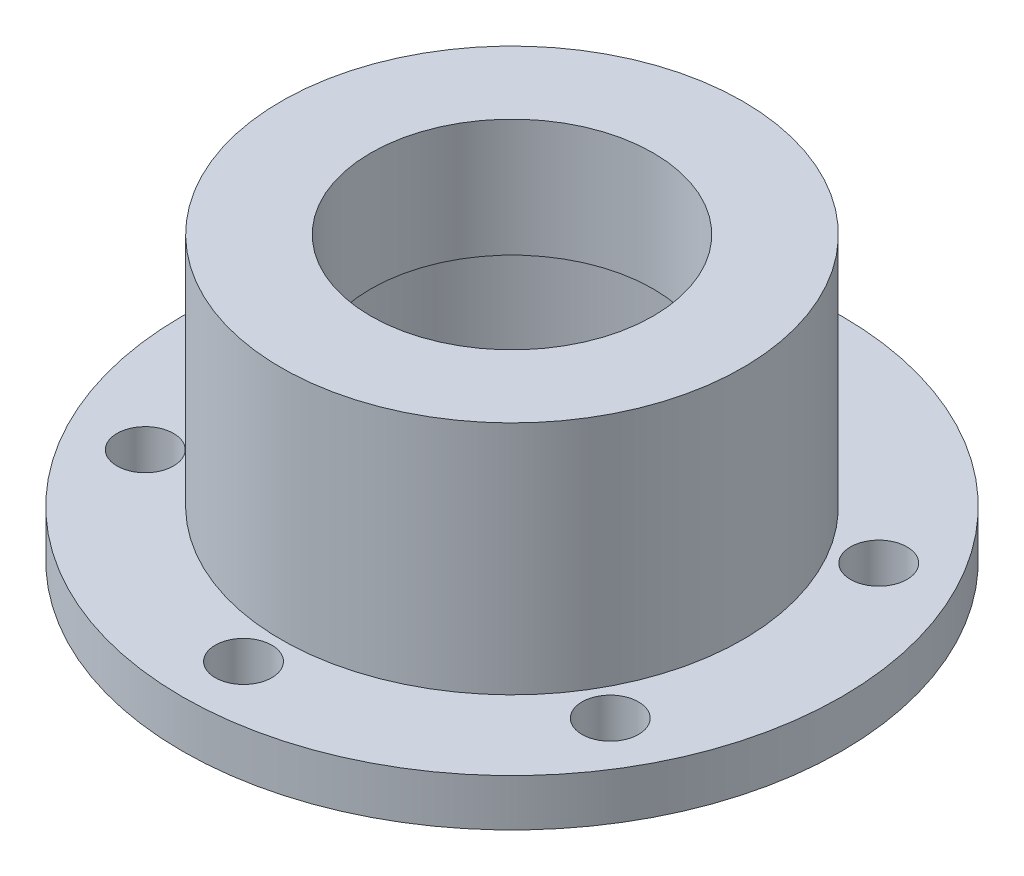
from build123d import *

# Parameters (mm, degrees)
SKETCH2_R          = 3
CUT_EXTRUDE3_DEPTH = 58.879184514


with BuildPart() as part:
    # Sketch1 → Revolve1 (revolve)
    with BuildSketch(Plane.XY, mode=Mode.PRIVATE) as revolve1_sk:
        Polygon((24.5, 0), (35, 0), (35, -5), (20, -5), (20, 12.5), (15, 12.5), (15, 25), (24.5, 25), align=None)
    revolve(revolve1_sk.sketch.rotate(Axis((0, 0, 0), (0, 1, 0)), 90), axis=Axis((0, 0, 0), (0, 1, 0)))

    # Sketch2 → Cut-Extrude3 (cut, through all)
    with BuildSketch(Plane(origin=(0, 25, 0), x_dir=(1, 0, 0), z_dir=(0, 1, 0))):
        with Locations(Location((0, 28.5, 0), (0, 0, 270))):
            Circle(SKETCH2_R)
        with Locations(Location((24.681724008, 14.25, 0), (0, 0, 270))):
            Circle(SKETCH2_R)
        with Locations(Location((24.681724008, -14.25, 0), (0, 0, 270))):
            Circle(SKETCH2_R)
        with Locations(Location((0, -28.5, 0), (0, 0, 270))):
            Circle(SKETCH2_R)
        with Locations(Location((-24.681724008, -14.25, 0), (0, 0, 270))):
            Circle(SKETCH2_R)
        with Locations(Location((-24.681724008, 14.25, 0), (0, 0, 270))):
            Circle(SKETCH2_R)
    extrude(amount=-CUT_EXTRUDE3_DEPTH, mode=Mode.SUBTRACT)


solid = part.part
